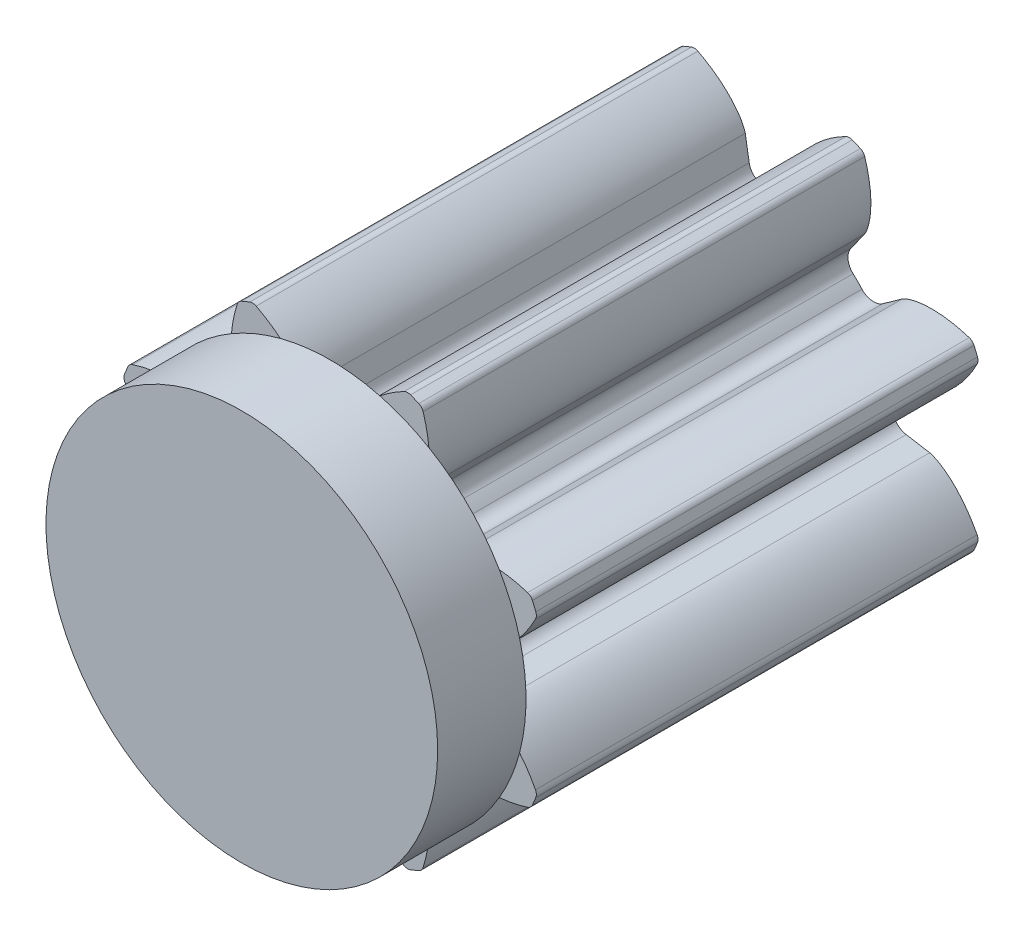
from build123d import *

# Parameters (mm, degrees)
SKETCH1_R                                 = 6.35
BOSS_EXTRUDE1_DEPTH                       = 12.7
CUT_EXTRUDE_DCLTBC_DEPTH                  = 16.554259867
FILLET_TIP_DCLTBC_R                       = 0.225840649
FILLET_ROOT_DCLTBC_R                      = 0.451681298
CIRPATTERN_DCLTBC_COUNT                   = 8
FILLET_TIP_DCLTBC_OF_CIRPATTERN_DCLTBC_R  = 0.225840649
FILLET_ROOT_DCLTBC_OF_CIRPATTERN_DCLTBC_R = 0.451681298
SKETCH4_R                                 = 5.63194408
BOSS_EXTRUDE2_DEPTH                       = 2.54


with BuildPart() as part:
    # Sketch1 → Boss-Extrude1 (new body)
    with BuildSketch(Plane.XY):
        Circle(SKETCH1_R)
    extrude(amount=BOSS_EXTRUDE1_DEPTH)

    # DCLTBC → Cut-Extrude-DCLTBC (cut, through all)
    with BuildSketch(Plane.XY):
        with BuildLine():
            Line((-0.762465098, 4.540469586), (-0.578384918, 3.444274544))
            ThreePointArc((-0.578384918, 3.444274544), (0, 3.4925), (0.578384918, 3.444274544))
            Line((0.578384918, 3.444274544), (0.762465098, 4.540469586))
            add(Edge.make_bspline(
                [(0.762465098, 4.540469586), (0.763034569, 4.543488036), (0.764819237, 4.551916605), (0.76893175, 4.567695247), (0.776679583, 4.593170604), (0.788064453, 4.625194838), (0.804494842, 4.666017173), (0.826031097, 4.713311361), (0.851950921, 4.764372266), (0.882541397, 4.81885718), (0.915143498, 4.872208333), (0.949571882, 4.924436701), (0.985567444, 4.975533126), (1.031137898, 5.036269094), (1.088495994, 5.107448593), (1.159378781, 5.188095877), (1.244219696, 5.276436139), (1.335260486, 5.362928889), (1.428549343, 5.445061504), (1.526869968, 5.524445472), (1.624871525, 5.598686298), (1.730580349, 5.671902497), (1.830170937, 5.737514811), (1.945834506, 5.80652891), (2.040393727, 5.860925157), (2.141307776, 5.913254628), (2.190891549, 5.938148554), (2.216425711, 5.950626611)],
                knots=[0, 0, 0, 0, 0, 0.005376748, 0.015083688, 0.02853182, 0.046610139, 0.064854849, 0.092110525, 0.119476175, 0.146842495, 0.174208853, 0.201574955, 0.228941013, 0.256307345, 0.307035032, 0.361767351, 0.41649966, 0.471231936, 0.525964281, 0.580696615, 0.635428982, 0.690161387, 0.744893688, 0.799626083, 0.854358408, 0.909090916, 0.909090916, 0.909090916, 0.909090916, 0.909090916], degree=4))
            ThreePointArc((2.216425711, 5.950626611), (0, 6.35), (-2.216425711, 5.950626611))
            add(Edge.make_bspline(
                [(-0.762465098, 4.540469586), (-0.763034569, 4.543488036), (-0.764819237, 4.551916605), (-0.76893175, 4.567695247), (-0.776679583, 4.593170604), (-0.788064453, 4.625194838), (-0.804494842, 4.666017173), (-0.826031097, 4.713311361), (-0.851950921, 4.764372266), (-0.882541397, 4.81885718), (-0.915143498, 4.872208333), (-0.949571882, 4.924436701), (-0.985567444, 4.975533126), (-1.031137898, 5.036269094), (-1.088495994, 5.107448593), (-1.159378781, 5.188095877), (-1.244219696, 5.276436139), (-1.335260486, 5.362928889), (-1.428549343, 5.445061504), (-1.526869968, 5.524445472), (-1.624871525, 5.598686298), (-1.730580349, 5.671902497), (-1.830170937, 5.737514811), (-1.945834506, 5.80652891), (-2.040393727, 5.860925157), (-2.141307776, 5.913254628), (-2.190891549, 5.938148554), (-2.216425711, 5.950626611)],
                knots=[0, 0, 0, 0, 0, 0.005376748, 0.015083688, 0.02853182, 0.046610139, 0.064854849, 0.092110525, 0.119476175, 0.146842495, 0.174208853, 0.201574955, 0.228941013, 0.256307345, 0.307035032, 0.361767351, 0.41649966, 0.471231936, 0.525964281, 0.580696615, 0.635428982, 0.690161387, 0.744893688, 0.799626083, 0.854358408, 0.909090916, 0.909090916, 0.909090916, 0.909090916, 0.909090916], degree=4))
        make_face()
    cut_extrude_dcltbc = extrude(amount=CUT_EXTRUDE_DCLTBC_DEPTH, mode=Mode.SUBTRACT)

    # Fillet-Tip-DCLTBC
    fillet_tip_dcltbc_edges = [part.edges().sort_by_distance(p)[0] for p in [
        (2.216425711, 5.950626611, 6.35),
        (-2.216425711, 5.950626611, 6.35),
    ]]
    fillet(fillet_tip_dcltbc_edges, radius=FILLET_TIP_DCLTBC_R)

    # Fillet-Root-DCLTBC
    fillet_root_dcltbc_edges = [part.edges().sort_by_distance(p)[0] for p in [
        (0.578384918, 3.444274544, 6.35),
        (-0.578384918, 3.444274544, 6.35),
    ]]
    fillet(fillet_root_dcltbc_edges, radius=FILLET_ROOT_DCLTBC_R)

    # CirPattern-DCLTBC: Cut-Extrude-DCLTBC ×8 about axis
    cirpattern_dcltbc_axis = Axis((0, 0, 12.7), (0, 0, 1))
    for i in range(1, CIRPATTERN_DCLTBC_COUNT):
        add(cut_extrude_dcltbc.rotate(cirpattern_dcltbc_axis, i * 360 / CIRPATTERN_DCLTBC_COUNT), mode=Mode.SUBTRACT)

    # Fillet-Tip-DCLTBC of CirPattern-DCLTBC
    fillet_tip_dcltbc_of_cirpattern_dcltbc_edges = [part.edges().sort_by_distance(p)[0] for p in [
        (-2.640478779, 5.77497808, 6.35),
        (-5.77497808, 2.640478779, 6.35),
        (-5.950626611, 2.216425711, 6.35),
        (-5.950626611, -2.216425711, 6.35),
        (-5.77497808, -2.640478779, 6.35),
        (-2.640478779, -5.77497808, 6.35),
        (-2.216425711, -5.950626611, 6.35),
        (2.216425711, -5.950626611, 6.35),
        (2.640478779, -5.77497808, 6.35),
        (5.77497808, -2.640478779, 6.35),
        (5.950626611, -2.216425711, 6.35),
        (5.950626611, 2.216425711, 6.35),
        (5.77497808, 2.640478779, 6.35),
        (2.640478779, 5.77497808, 6.35),
    ]]
    fillet(fillet_tip_dcltbc_of_cirpattern_dcltbc_edges, radius=FILLET_TIP_DCLTBC_OF_CIRPATTERN_DCLTBC_R)

    # Fillet-Root-DCLTBC of CirPattern-DCLTBC
    fillet_root_dcltbc_of_cirpattern_dcltbc_edges = [part.edges().sort_by_distance(p)[0] for p in [
        (-2.026489989, 2.844449784, 6.35),
        (-2.844449784, 2.026489989, 6.35),
        (-3.444274544, 0.578384918, 6.35),
        (-3.444274544, -0.578384918, 6.35),
        (-2.844449784, -2.026489989, 6.35),
        (-2.026489989, -2.844449784, 6.35),
        (-0.578384918, -3.444274544, 6.35),
        (0.578384918, -3.444274544, 6.35),
        (2.026489989, -2.844449784, 6.35),
        (2.844449784, -2.026489989, 6.35),
        (3.444274544, -0.578384918, 6.35),
        (3.444274544, 0.578384918, 6.35),
        (2.844449784, 2.026489989, 6.35),
        (2.026489989, 2.844449784, 6.35),
    ]]
    fillet(fillet_root_dcltbc_of_cirpattern_dcltbc_edges, radius=FILLET_ROOT_DCLTBC_OF_CIRPATTERN_DCLTBC_R)

    # Sketch4 → Boss-Extrude2 (add)
    with BuildSketch(Plane.XY.offset(12.7)):
        with Locations(Location((0, 0, 0), (0, 0, 165.266889092))):
            Circle(SKETCH4_R)
    extrude(amount=BOSS_EXTRUDE2_DEPTH)


solid = part.part
